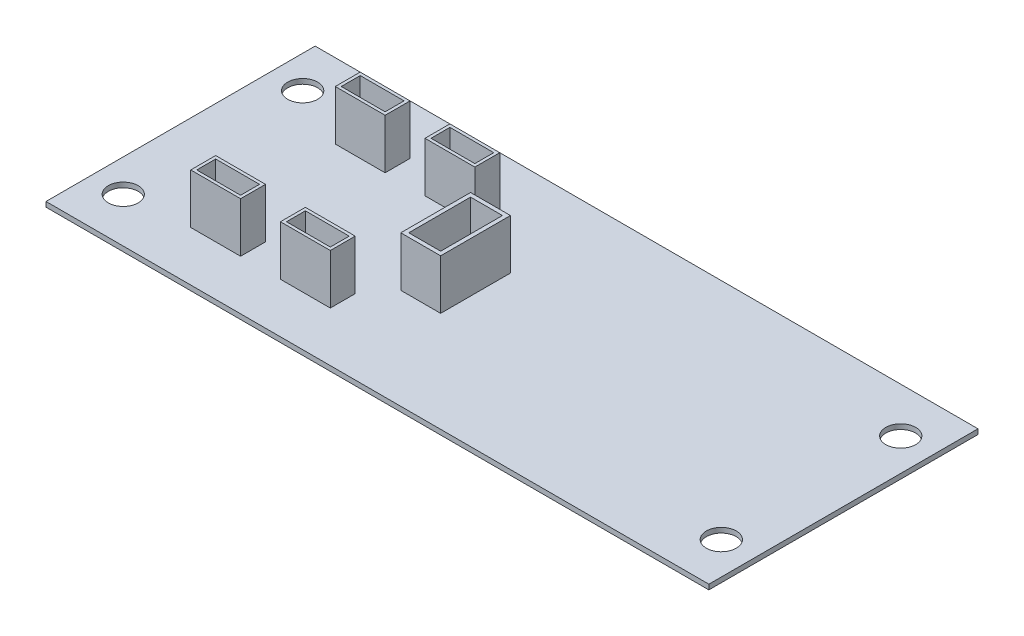
from build123d import *

# Parameters (mm, degrees)
SKETCH1_W           = 66.5
SKETCH1_H           = 27
SKETCH1_R           = 1.5
BOSS_EXTRUDE1_DEPTH = 0.5
SKETCH2_W           = 5
SKETCH2_H           = 2.5
SKETCH2_W_2         = 4.4
SKETCH2_H_2         = 1.9
BOSS_EXTRUDE2_DEPTH = 5
SKETCH4_W           = 4
SKETCH4_H           = 7
SKETCH4_W_2         = 3.2
SKETCH4_H_2         = 6.2
BOSS_EXTRUDE3_DEPTH = 5


with BuildPart() as part:
    # Sketch1 → Boss-Extrude1 (new body)
    with BuildSketch(Plane(origin=(0, 0, 0), x_dir=(1, 0, 0), z_dir=(0, 1, 0))):
        Rectangle(SKETCH1_W, SKETCH1_H)
        with Locations(Location((-30, 9, 0), (0, 0, 270))):
            Circle(SKETCH1_R, mode=Mode.SUBTRACT)
        with Locations(Location((-30, -9, 0), (0, 0, 270))):
            Circle(SKETCH1_R, mode=Mode.SUBTRACT)
        with Locations(Location((30, 9, 0), (0, 0, 270))):
            Circle(SKETCH1_R, mode=Mode.SUBTRACT)
        with Locations(Location((30, -9, 0), (0, 0, 270))):
            Circle(SKETCH1_R, mode=Mode.SUBTRACT)
    extrude(amount=BOSS_EXTRUDE1_DEPTH)

    # Sketch2 → Boss-Extrude2 (add)
    # profile 1 of 4: a face of its own
    with BuildSketch(Plane(origin=(0, 0.5, 0), x_dir=(1, 0, 0), z_dir=(0, 1, 0))):
        with Locations((-21.228920611, 7.25)):
            Rectangle(SKETCH2_W, SKETCH2_H)
        with Locations((-21.228920611, 7.25)):
            Rectangle(SKETCH2_W_2, SKETCH2_H_2, mode=Mode.SUBTRACT)
    # profile 2 of 4: a face of its own
    with BuildSketch(Plane(origin=(0, 0.5, 0), x_dir=(1, 0, 0), z_dir=(0, 1, 0))):
        with Locations((-12.228920611, 7.25)):
            Rectangle(SKETCH2_W, SKETCH2_H)
        with Locations((-12.228920611, 7.25)):
            Rectangle(SKETCH2_W_2, SKETCH2_H_2, mode=Mode.SUBTRACT)
    # profile 3 of 4: a face of its own
    with BuildSketch(Plane(origin=(0, 0.5, 0), x_dir=(1, 0, 0), z_dir=(0, 1, 0))):
        with Locations((-12.228920611, -7.25)):
            Rectangle(SKETCH2_W, SKETCH2_H)
        with Locations((-12.228920611, -7.25)):
            Rectangle(SKETCH2_W_2, SKETCH2_H_2, mode=Mode.SUBTRACT)
    # profile 4 of 4: a face of its own
    with BuildSketch(Plane(origin=(0, 0.5, 0), x_dir=(1, 0, 0), z_dir=(0, 1, 0))):
        with Locations((-21.228920611, -7.25)):
            Rectangle(SKETCH2_W, SKETCH2_H)
        with Locations((-21.228920611, -7.25)):
            Rectangle(SKETCH2_W_2, SKETCH2_H_2, mode=Mode.SUBTRACT)
    extrude(amount=BOSS_EXTRUDE2_DEPTH)

    # Sketch4 → Boss-Extrude3 (add)
    with BuildSketch(Plane(origin=(0, 0.5, 0), x_dir=(1, 0, 0), z_dir=(0, 1, 0))):
        with Locations((-5.732400649, 0.074372007)):
            Rectangle(SKETCH4_W, SKETCH4_H)
        with Locations((-5.732400649, 0.074372007)):
            Rectangle(SKETCH4_W_2, SKETCH4_H_2, mode=Mode.SUBTRACT)
    extrude(amount=BOSS_EXTRUDE3_DEPTH)


solid = part.part
